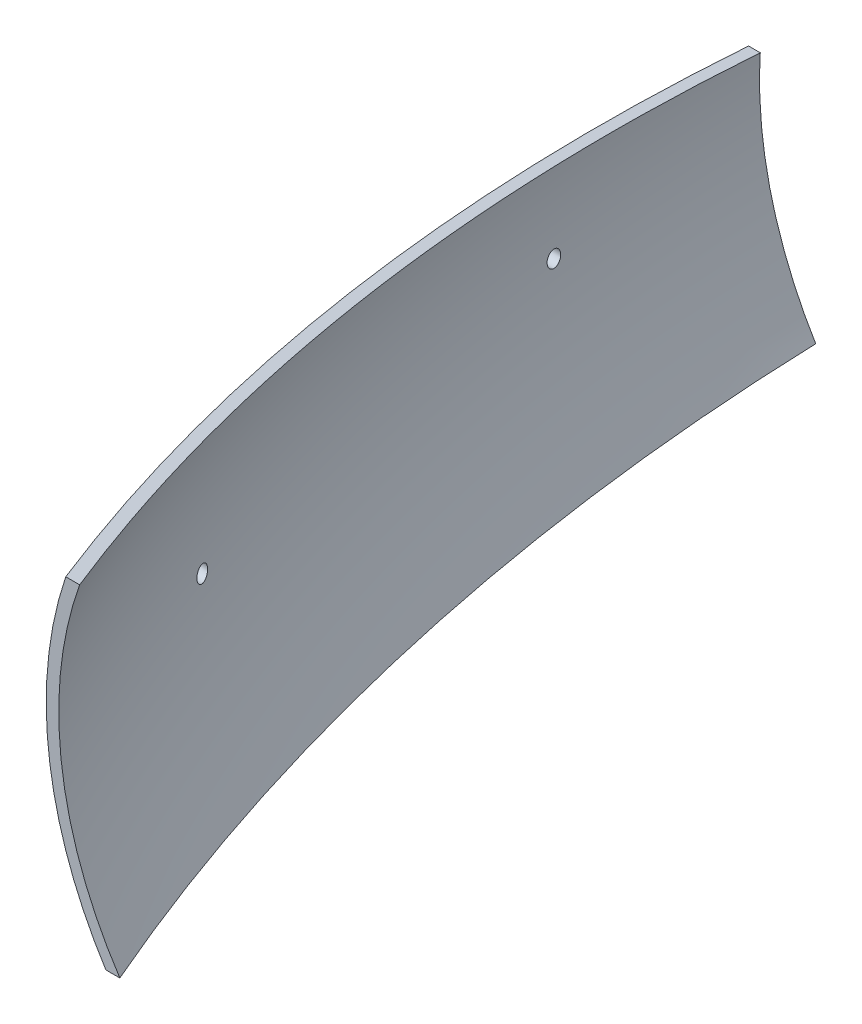
from build123d import *

# Parameters (mm, degrees)
REVOLVE1_ANGLE          = 88
CUT_EXTRUDE2_DEPTH      = 2771.780439466
CUT_EXTRUDE2_DEPTH_BACK = 2771.780439466
SKETCH5_W               = 5800.528681758
SKETCH5_H               = 2435.889164845
CUT_EXTRUDE4_DEPTH      = 838.656303446
CUT_EXTRUDE4_DEPTH_BACK = 838.656303446
SKETCH6_R               = 6


with BuildPart() as part:
    # Sketch2 → Revolve1 (revolve)
    with BuildSketch(Plane.XY):
        with BuildLine():
            Line((72.370392529, 0), (82.370392529, 0))
            ThreePointArc((82.370392529, 0), (40.524594063, 121.838677192), (53.578690935, 250))
            Line((53.578690935, 250), (43.578690935, 250))
            ThreePointArc((43.578690935, 250), (31.595154891, 121.961970263), (72.370392529, 0))
        make_face()
    revolve(axis=Axis((2000, -13.371705106, 0), (0, 1, 0)), revolution_arc=REVOLVE1_ANGLE)

    # Sketch5 → Cut-Extrude2 (cut, two sides: drawn at the far end of the back side and taken through both)
    with BuildSketch(Plane(origin=(0, 0, 0), x_dir=(0, 0, -1), z_dir=(1, 0, 0)).offset(-CUT_EXTRUDE2_DEPTH_BACK)):
        with Locations((76.037885341, -87.116535175)):
            Rectangle(SKETCH5_W, SKETCH5_H)
        Polygon((-762.459239957, 250), (-762.459239957, 0), (-62.459239957, 0), (-62.459239957, 175), align=None, mode=Mode.SUBTRACT)
    extrude(amount=CUT_EXTRUDE2_DEPTH + CUT_EXTRUDE2_DEPTH_BACK, mode=Mode.SUBTRACT)

    # Sketch6 → Cut-Extrude4 (cut, two sides: drawn at the far end of the back side and taken through both)
    with BuildSketch(Plane(origin=(0, 0, 0), x_dir=(0, 0, -1), z_dir=(1, 0, 0)).offset(-CUT_EXTRUDE4_DEPTH_BACK)):
        with Locations(Location((-587.459239957, 130.34, 0), (0, 0, 320.485227815))):
            Circle(SKETCH6_R)
        with Locations(Location((-237.459239957, 130.34, 0), (0, 0, 304.628365323))):
            Circle(SKETCH6_R)
    extrude(amount=CUT_EXTRUDE4_DEPTH + CUT_EXTRUDE4_DEPTH_BACK, mode=Mode.SUBTRACT)


solid = part.part
